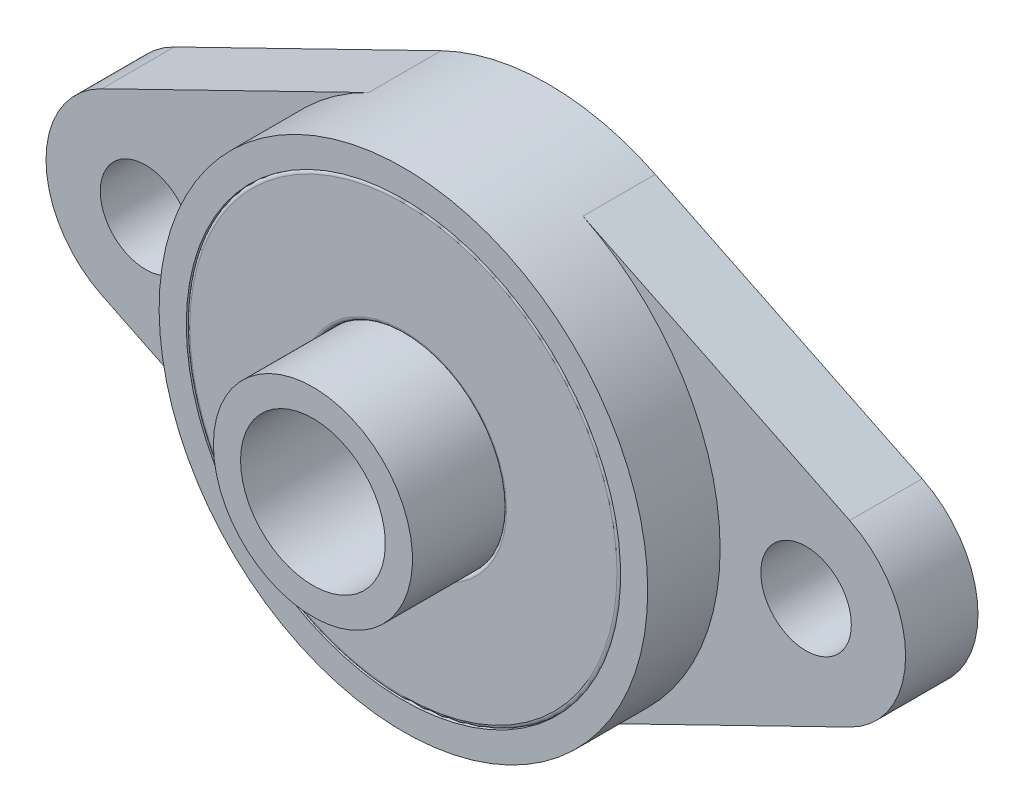
from build123d import *

# Parameters (mm, degrees)
SKETCH1_R             = 13.5
SKETCH1_R_2           = 12
BOSS_EXTRUDE1_DEPTH   = 13
SKETCH1_R_3           = 5.5
SKETCH1_R_4           = 4
BOSS_EXTRUDE1_2_DEPTH = 13
SKETCH2_R             = 2.5
BOSS_EXTRUDE3_DEPTH   = 4
SKETCH4_W             = 74
SKETCH4_H             = 74
SKETCH4_R             = 8.75
CUT_EXTRUDE1_DEPTH    = 5
SKETCH1_3_R           = 12
SKETCH1_3_R_2         = 5.5
BOSS_EXTRUDE2_DEPTH   = 8
FILLET6_R             = 0.2


with BuildPart() as part:
    # Sketch1 → Boss-Extrude1 (new body)
    with BuildSketch(Plane.XY):
        with Locations(Location((0, 0, 0), (0, 0, 180))):
            Circle(SKETCH1_R)
        with Locations(Location((0, 0, 0), (0, 0, 180))):
            Circle(SKETCH1_R_2, mode=Mode.SUBTRACT)
    extrude(amount=BOSS_EXTRUDE1_DEPTH)

    # Sketch2 → Boss-Extrude3 (add)
    with BuildSketch(Plane(origin=(0, 0, 0), x_dir=(-1, 0, 0), z_dir=(0, 0, -1))):
        with BuildLine():
            Line((5.917808219, 12.133818273), (20.660958904, 4.943407445))
            ThreePointArc((20.660958904, 4.943407445), (23.75, 0), (20.660958904, -4.943407445))
            Line((20.660958904, -4.943407445), (5.917808219, -12.133818273))
            ThreePointArc((5.917808219, -12.133818273), (13.5, 0), (5.917808219, 12.133818273))
        make_face()
        with Locations((18.25, 0)):
            Circle(SKETCH2_R, mode=Mode.SUBTRACT)
    boss_extrude3 = extrude(amount=-BOSS_EXTRUDE3_DEPTH)

    # Mirror1: Boss-Extrude3 across plane
    add(boss_extrude3.mirror(Plane(origin=(0, 0, 0), x_dir=(0, 0, 1), z_dir=(1, 0, 0))))

    # Sketch4 → Cut-Extrude1 (cut)
    with BuildSketch(Plane.XY.offset(13)):
        Rectangle(SKETCH4_W, SKETCH4_H)
        Circle(SKETCH4_R, mode=Mode.SUBTRACT)
    extrude(amount=-CUT_EXTRUDE1_DEPTH, mode=Mode.SUBTRACT)


with BuildPart() as body_2:
    # Sketch1 → Boss-Extrude1 2 (new body)
    with BuildSketch(Plane.XY):
        with Locations(Location((0, 0, 0), (0, 0, 180))):
            Circle(SKETCH1_R_3)
        with Locations(Location((0, 0, 0), (0, 0, 180))):
            Circle(SKETCH1_R_4, mode=Mode.SUBTRACT)
    extrude(amount=BOSS_EXTRUDE1_2_DEPTH)


with BuildPart() as body_3:
    # Sketch1<3> → Boss-Extrude2 (new body)
    with BuildSketch(Plane.XY):
        Circle(SKETCH1_3_R)
        Circle(SKETCH1_3_R_2, mode=Mode.SUBTRACT)
    extrude(amount=BOSS_EXTRUDE2_DEPTH)

    # Fillet6
    fillet6_edges = [body_3.edges().sort_by_distance(p)[0] for p in [
        (-12, 0, 8),
        (-12, 0, 0),
        (-5.5, 0, 0),
        (-5.5, 0, 8),
    ]]
    fillet(fillet6_edges, radius=FILLET6_R)


solid = Compound([part.part, body_2.part, body_3.part])
